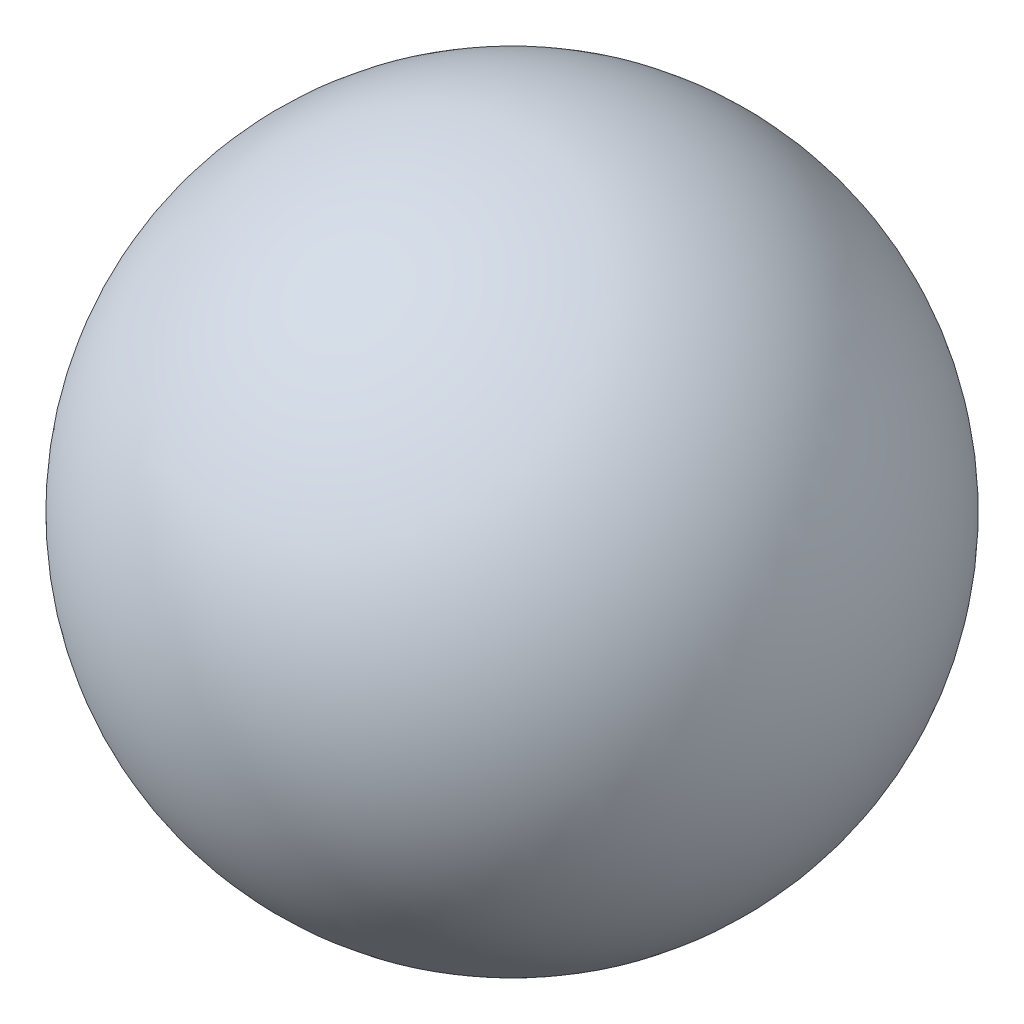
from build123d import *
from build123d.topology import SkipClean


with BuildPart() as part:
    # Sketch1 → Revolve11 (revolve)
    with SkipClean():  # the faces are left unmerged after this step: merging them gives an invalid solid
        with BuildSketch(Plane.XY, mode=Mode.PRIVATE) as revolve11_sk:
            with BuildLine():
                ThreePointArc((8, 1.851360674), (5.656854249, 7.508214923), (0, 9.851360674))
                Line((0, 9.851360674), (0, -6.148639326))
                ThreePointArc((0, -6.148639326), (5.656854249, -3.805493576), (8, 1.851360674))
            make_face()
            with BuildLine():
                Line((0, -6.148639326), (0, 9.851360674))
                ThreePointArc((0, 9.851360674), (-8, 1.851360674), (0, -6.148639326))
            make_face()
        revolve(revolve11_sk.sketch.rotate(Axis((0, 9.851360674, 0), (0, -1, 0)), 180), axis=Axis((0, 9.851360674, 0), (0, -1, 0)))


solid = part.part
